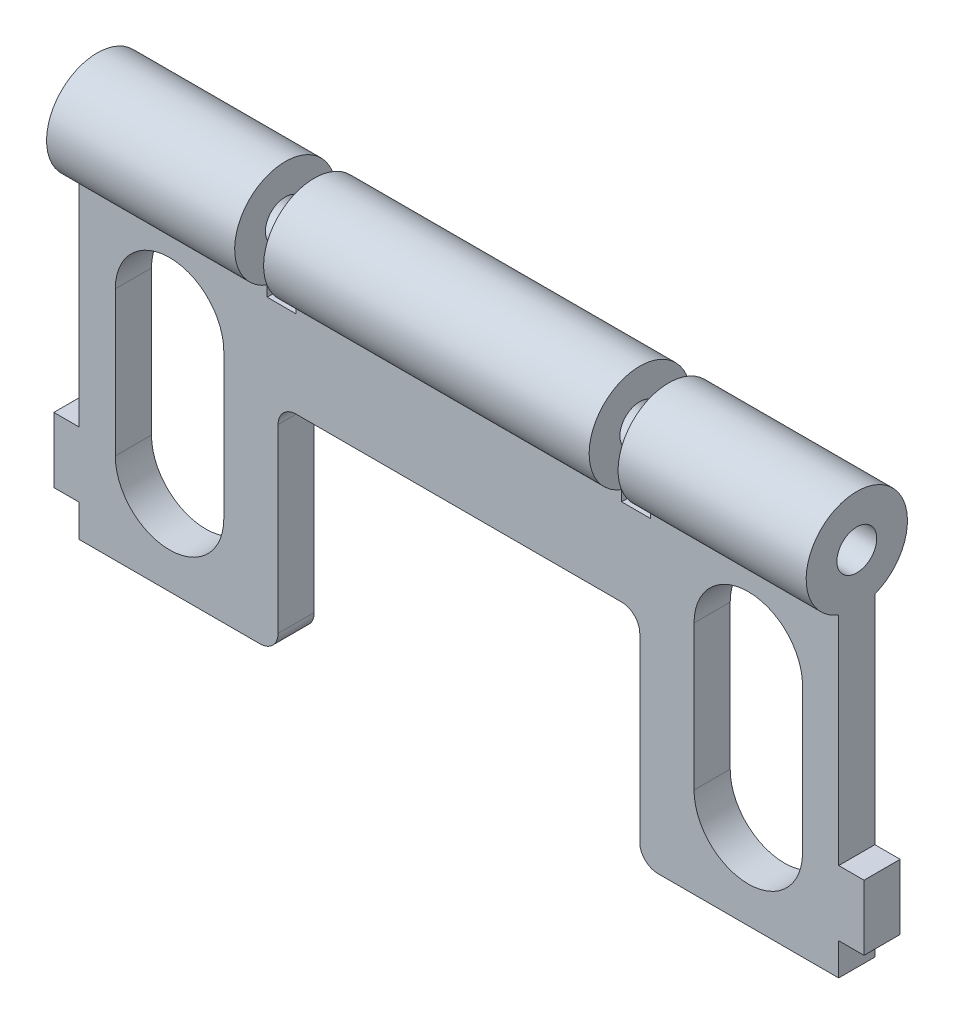
from build123d import *

# Parameters (mm, degrees)
BOSS_EXTRUDE1_DEPTH     = 10.5
SKETCH2_W               = 10
SKETCH2_H               = 6
SKETCH2_W_2             = 0.8
SKETCH2_H_2             = 3
CUT_EXTRUDE1_DEPTH      = 10.5
M1_4X0_3_TAPPED_HOLE1_D = 1.1
SKETCH4_W               = 0.7
SKETCH4_H               = 1.8
BOSS_EXTRUDE2_DEPTH     = 0.5
FILLET1_R               = 0.5


with BuildPart() as part:
    # Sketch1 → Boss-Extrude1 (new, symmetric)
    with BuildSketch(Plane(origin=(0, 0, 0), x_dir=(0, 0, -1), z_dir=(1, 0, 0))):
        with BuildLine():
            Line((-0.5, 3.692330317), (-0.5, 5))
            Line((-0.5, 5), (0.5, 5))
            Line((0.5, 5), (0.5, 3.692330317))
            ThreePointArc((0.5, 3.692330317), (1.153256259, 4.206274607), (1.4, 5))
            ThreePointArc((1.4, 5), (-0.793725393, 6.153256259), (-0.5, 3.692330317))
        make_face()
        with BuildLine():
            Line((0.5, 5), (-0.5, 5))
            Line((-0.5, 5), (-0.5, 3.692330317))
            ThreePointArc((-0.5, 3.692330317), (0, 3.6), (0.5, 3.692330317))
            Line((0.5, 3.692330317), (0.5, 5))
        make_face()
        with BuildLine():
            ThreePointArc((0.5, 3.692330317), (0, 3.6), (-0.5, 3.692330317))
            Line((-0.5, 3.692330317), (-0.5, -5))
            Line((-0.5, -5), (0.5, -5))
            Line((0.5, -5), (0.5, 3.692330317))
        make_face()
    extrude(amount=BOSS_EXTRUDE1_DEPTH, both=True)

    # Sketch2 → Cut-Extrude1 (cut, symmetric)
    with BuildSketch(Plane.XY.offset(0.5)):
        with Locations((0, -2)):
            Rectangle(SKETCH2_W, SKETCH2_H)
        with Locations((-4.9, 4.9)):
            Rectangle(SKETCH2_W_2, SKETCH2_H_2)
        with BuildLine():
            Line((-6.5, 1.5), (-6.5, -2.5))
            ThreePointArc((-6.5, -2.5), (-8, -4), (-9.5, -2.5))
            Line((-9.5, -2.5), (-9.5, 1.5))
            ThreePointArc((-9.5, 1.5), (-8, 3), (-6.5, 1.5))
        make_face()
        with BuildLine():
            Line((6.5, 1.5), (6.5, -2.5))
            ThreePointArc((6.5, -2.5), (8, -4), (9.5, -2.5))
            Line((9.5, -2.5), (9.5, 1.5))
            ThreePointArc((9.5, 1.5), (8, 3), (6.5, 1.5))
        make_face()
        with Locations((4.9, 4.9)):
            Rectangle(SKETCH2_W_2, SKETCH2_H_2)
    extrude(amount=CUT_EXTRUDE1_DEPTH, both=True, mode=Mode.SUBTRACT)

    # M1.4x0.3 Tapped Hole1 (through all)
    with Locations(Plane(origin=(10.5, 5, 0), x_dir=(0, 0, 1), z_dir=(1, 0, 0))):
        with Locations((0, 0)):
            Hole(M1_4X0_3_TAPPED_HOLE1_D / 2)

    # Sketch4 → Boss-Extrude2 (add, symmetric)
    with BuildSketch(Plane.XY):
        with Locations((10.85, -3.207669683)):
            Rectangle(SKETCH4_W, SKETCH4_H)
    boss_extrude2 = extrude(amount=BOSS_EXTRUDE2_DEPTH, both=True)

    # Mirror1: Boss-Extrude2 across plane
    add(boss_extrude2.mirror(Plane(origin=(0, 0, 0), x_dir=(0, 0, 1), z_dir=(1, 0, 0))))

    # Fillet1
    fillet1_edges = [part.edges().sort_by_distance(p)[0] for p in [
        (-5, -5, 0),
        (-5, 1, 0),
        (5, 1, 0),
        (5, -5, 0),
    ]]
    fillet(fillet1_edges, radius=FILLET1_R)


solid = part.part
